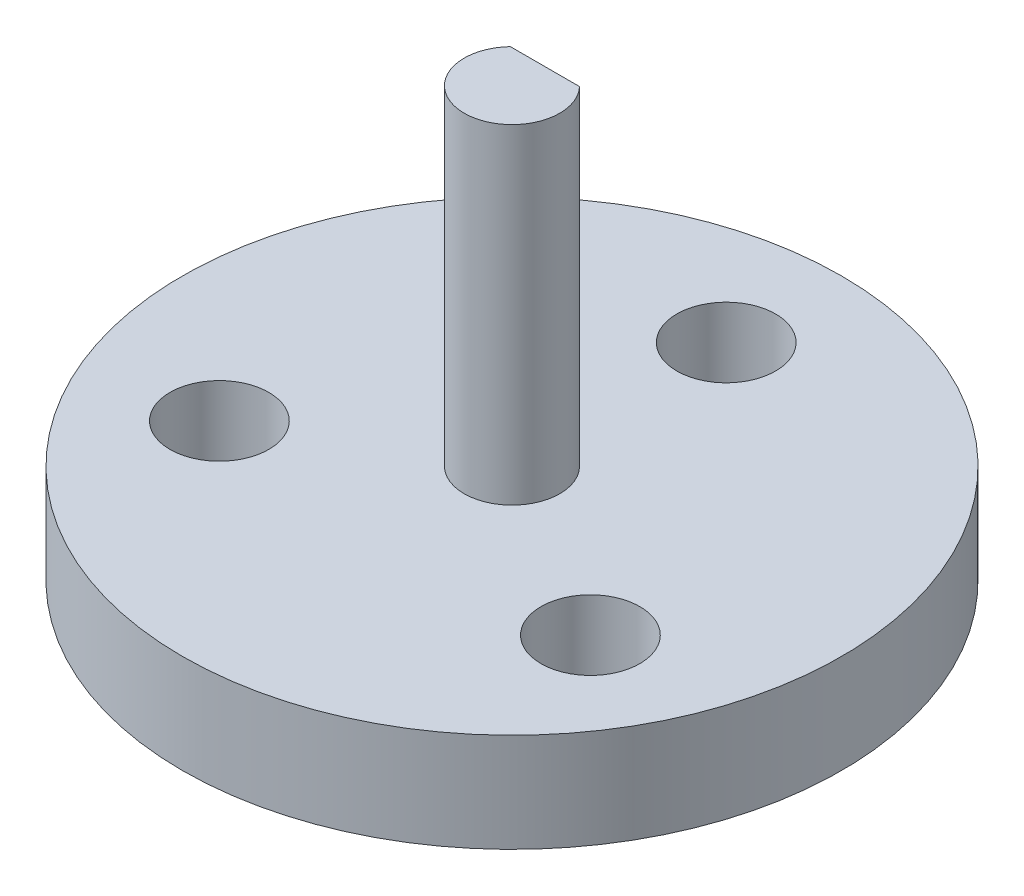
from build123d import *

# Parameters (mm, degrees)
SKETCH_1_R      = 10
SKETCH_1_R_2    = 1.5
EXTRUDE_1_DEPTH = 3
EXTRUDE_2_DEPTH = 13


with BuildPart() as part:
    # 草图1 → 凸台-拉伸1 (new body)
    with BuildSketch(Plane(origin=(0, 0, 0), x_dir=(1, 0, 0), z_dir=(0, 1, 0))):
        with Locations(Location((0, 0, 0), (0, 0, 270))):
            Circle(SKETCH_1_R)
        with Locations(Location((0, 6.5, 0), (0, 0, 270))):
            Circle(SKETCH_1_R_2, mode=Mode.SUBTRACT)
        with Locations(Location((5.629165125, -3.25, 0), (0, 0, 270))):
            Circle(SKETCH_1_R_2, mode=Mode.SUBTRACT)
        with Locations(Location((-5.629165125, -3.25, 0), (0, 0, 270))):
            Circle(SKETCH_1_R_2, mode=Mode.SUBTRACT)
    extrude(amount=EXTRUDE_1_DEPTH)

    # 草图2 → 凸台-拉伸2 (add)
    with BuildSketch(Plane(origin=(0, 0, 0), x_dir=(1, 0, 0), z_dir=(0, 1, 0))):
        with BuildLine():
            Line((-1.05, 1), (1.05, 1))
            ThreePointArc((1.05, 1), (0, -1.45), (-1.05, 1))
        make_face()
    extrude(amount=EXTRUDE_2_DEPTH)


solid = part.part
